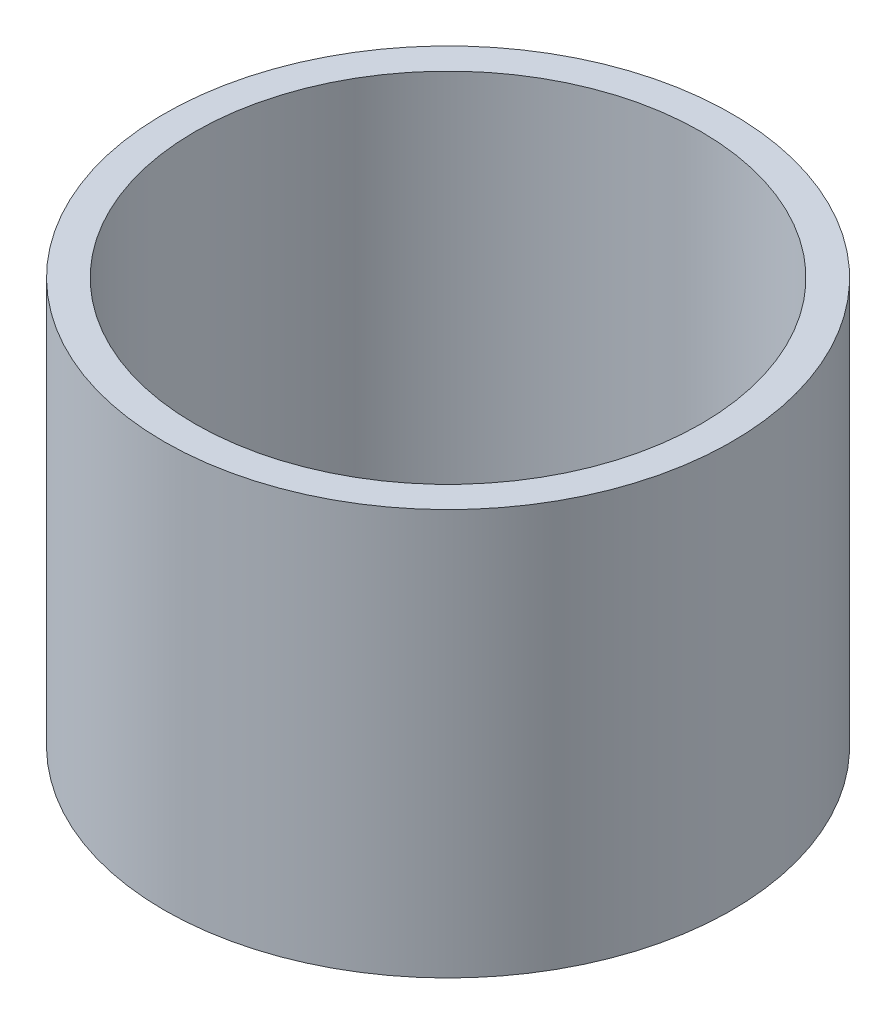
from build123d import *

# Parameters (mm, degrees)
SKETCH1_R           = 14
SKETCH1_R_2         = 12.477707268
BOSS_EXTRUDE1_DEPTH = 20


with BuildPart() as part:
    # Sketch1 → Boss-Extrude1 (new body)
    with BuildSketch(Plane(origin=(0, 0, 0), x_dir=(1, 0, 0), z_dir=(0, 1, 0))):
        with Locations(Location((0, 0, 0), (0, 0, 270))):
            Circle(SKETCH1_R)
        with Locations(Location((0, 0, 0), (0, 0, 270))):
            Circle(SKETCH1_R_2, mode=Mode.SUBTRACT)
    extrude(amount=BOSS_EXTRUDE1_DEPTH)


solid = part.part
